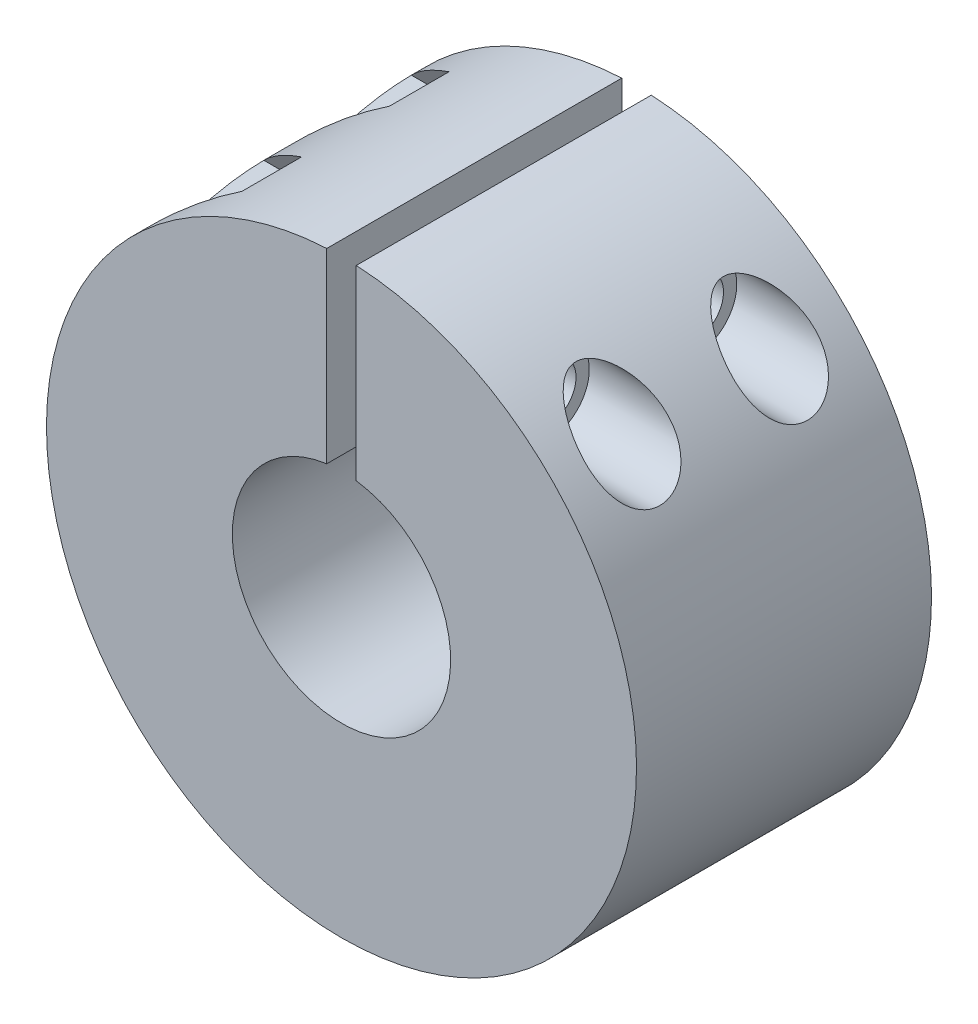
from build123d import *

# Parameters (mm, degrees)
SKETCH1_R                       = 25.4
BOSS_EXTRUDE1_DEPTH             = 25.4
SKETCH2_R                       = 4.8895
CUT_EXTRUDE1_DEPTH              = 11.43
SKETCH3_R                       = 9.398
CUT_EXTRUDE2_DEPTH              = 13.97
DIVIDE_REACH                    = 45.994
SKETCH7_W                       = 2.54
SKETCH7_H                       = 25.4
SKETCH8_R                       = 2.413
F_4_40_THROUGH_HOLE_DEPTH       = 45.739343983
SKETCH9_R                       = 3.556
F_4_40_HEAD_CLEARANCE_DEPTH     = 52.446758086
F_4_40_HEX_NUT_DEPRESSION_DEPTH = 52.446758086
LPATTERN1_COUNT                 = 2
LPATTERN1_PITCH                 = 12.7


with BuildPart() as part:
    # Sketch1 → Boss-Extrude1 (new body)
    with BuildSketch(Plane.XY):
        Circle(SKETCH1_R)
    extrude(amount=BOSS_EXTRUDE1_DEPTH)

    # Sketch2 → Cut-Extrude1 (cut)
    with BuildSketch(Plane(origin=(0, 0, 0), x_dir=(-1, 0, 0), z_dir=(0, 0, -1))):
        Circle(SKETCH2_R)
    extrude(amount=-CUT_EXTRUDE1_DEPTH, mode=Mode.SUBTRACT)

    # Sketch3 → Cut-Extrude2 (cut)
    with BuildSketch(Plane.XY.offset(25.4)):
        Circle(SKETCH3_R)
    extrude(amount=-CUT_EXTRUDE2_DEPTH, mode=Mode.SUBTRACT)

    # Sketch7 → Divide (cut, up to next)
    with BuildSketch(Plane(origin=(0, 0, 0), x_dir=(-1, 0, 0), z_dir=(0, 0, -1)), mode=Mode.PRIVATE) as divide_sk1:
        with Locations((0, 12.7)):
            Rectangle(SKETCH7_W, SKETCH7_H)
    divide_tool1 = extrude(divide_sk1.sketch, amount=-DIVIDE_REACH, mode=Mode.PRIVATE) & part.part
    add(divide_tool1.solids().sort_by_distance((0, 12.7, 0))[0], mode=Mode.SUBTRACT)

    # Sketch8 → 4-40 through hole (cut, symmetric)
    with BuildSketch(Plane.ZY.offset(-1.27)):
        with Locations((19.05, 17.748230131)):
            Circle(SKETCH8_R)
    f_4_40_through_hole = extrude(amount=F_4_40_THROUGH_HOLE_DEPTH, both=True, mode=Mode.SUBTRACT)

    # Sketch9 → 4-40 head clearance (cut, through all)
    with BuildSketch(Plane.ZY.offset(-11.43)):
        with Locations((19.05, 17.748230131)):
            Circle(SKETCH9_R)
    f_4_40_head_clearance = extrude(amount=-F_4_40_HEAD_CLEARANCE_DEPTH, mode=Mode.SUBTRACT)

    # Sketch10 → 4-40 hex nut depression (cut, through all)
    with BuildSketch(Plane(origin=(-11.43, 0, 0), x_dir=(0, 0, -1), z_dir=(1, 0, 0))):
        Polygon((-21.616321947, 13.303230131), (-16.483678053, 13.303230131), (-13.917356107, 17.748230131), (-16.483678053, 22.193230131), (-21.616321947, 22.193230131), (-24.182643893, 17.748230131), align=None)
    f_4_40_hex_nut_depression = extrude(amount=-F_4_40_HEX_NUT_DEPRESSION_DEPTH, mode=Mode.SUBTRACT)

    # LPattern1: 4-40 through hole, 4-40 head clearance, 4-40 hex nut depression ×2
    with Locations(*[(0, 0, -i * LPATTERN1_PITCH) for i in range(1, LPATTERN1_COUNT)]):
        add(f_4_40_through_hole, mode=Mode.SUBTRACT)
        add(f_4_40_head_clearance, mode=Mode.SUBTRACT)
        add(f_4_40_hex_nut_depression, mode=Mode.SUBTRACT)


solid = part.part
